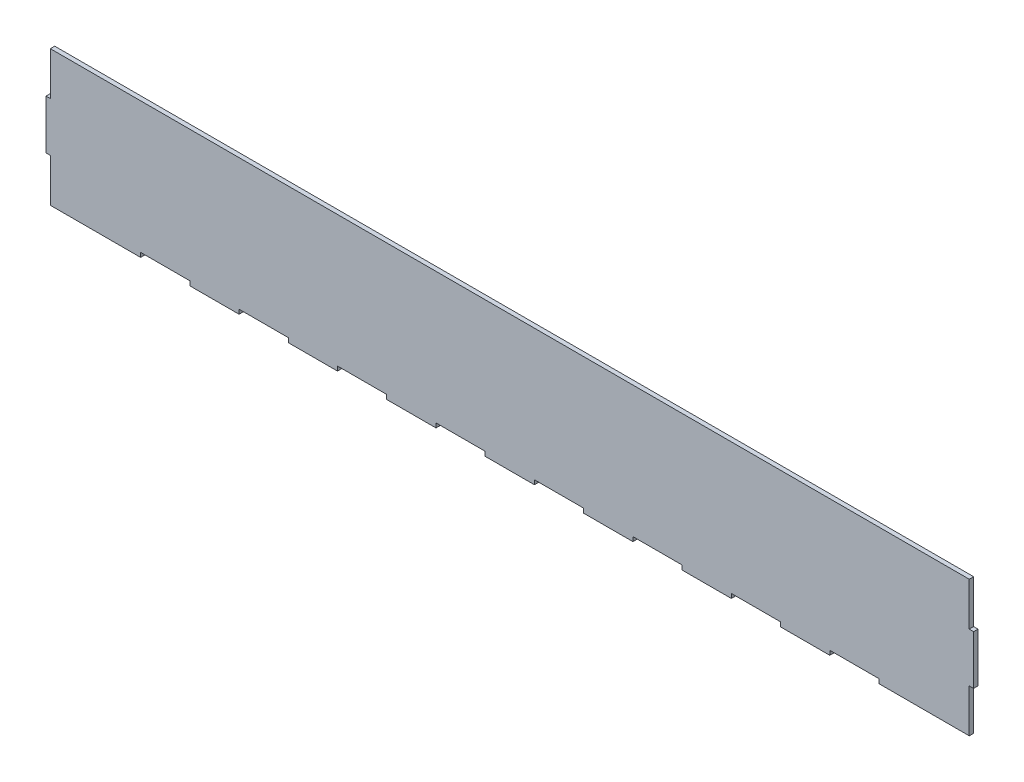
from build123d import *

# Parameters (mm, degrees)
BOSS_EXTRUDE1_DEPTH = 3


with BuildPart() as part:
    # Model → Boss-Extrude1 (new body)
    with BuildSketch(Plane.XY):
        Polygon((642, 192), (642, 162.375), (639, 162.375), (639, 128.625), (642, 128.625), (642, 99), (703.875, 99), (703.875, 102), (737.625, 102), (737.625, 99), (771.375, 99), (771.375, 102), (805.125, 102), (805.125, 99), (838.875, 99), (838.875, 102), (872.625, 102), (872.625, 99), (906.375, 99), (906.375, 102), (940.125, 102), (940.125, 99), (973.875, 99), (973.875, 102), (1007.625, 102), (1007.625, 99), (1041.375, 99), (1041.375, 102), (1075.125, 102), (1075.125, 99), (1108.875, 99), (1108.875, 102), (1142.625, 102), (1142.625, 99), (1176.375, 99), (1176.375, 102), (1210.125, 102), (1210.125, 99), (1243.875, 99), (1272, 99), (1272, 128.625), (1275, 128.625), (1275, 162.375), (1272, 162.375), (1272, 192), align=None)
    extrude(amount=BOSS_EXTRUDE1_DEPTH)


solid = part.part
